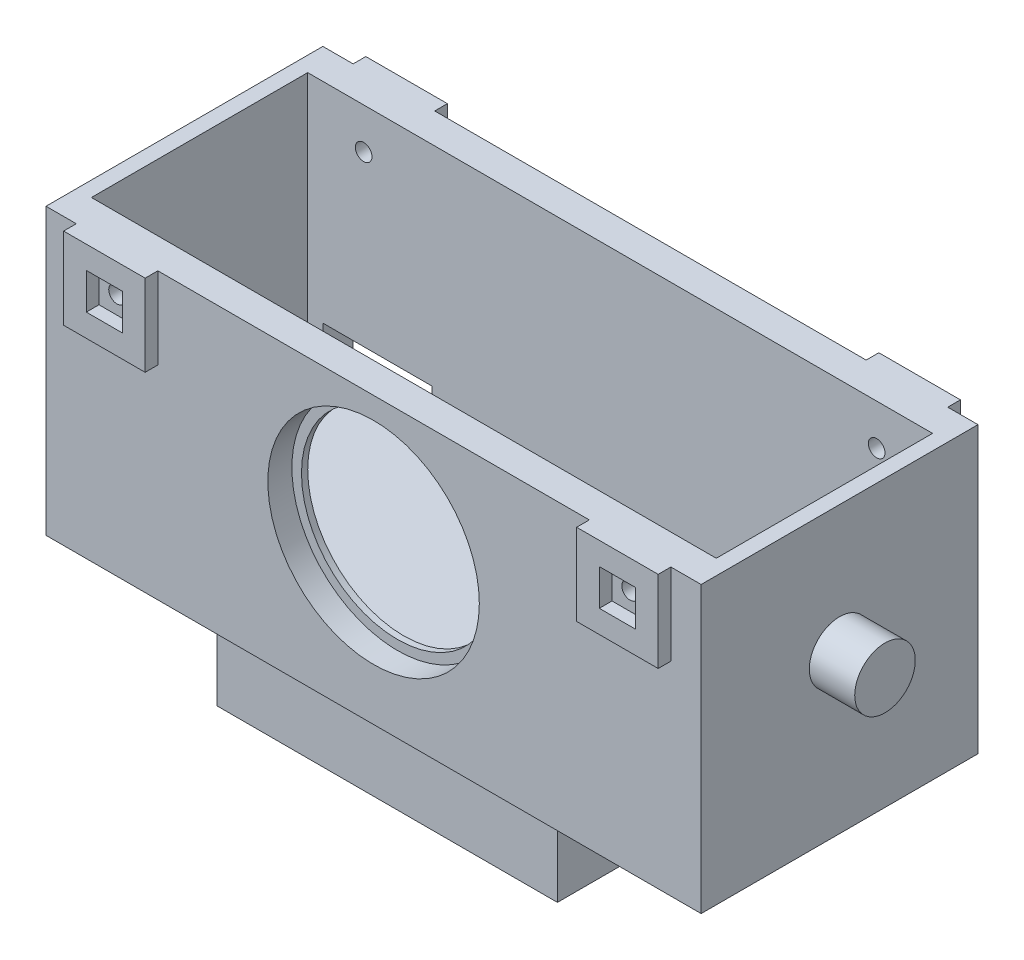
from build123d import *

# Parameters (mm, degrees)
SKETCH1_W                 = 36.575
SKETCH1_H                 = 41.655
SKETCH1_W_2               = 28.575
SKETCH1_H_2               = 33.655
BOSS_EXTRUDE1_DEPTH       = 41.275
SKETCH2_W                 = 36.575
SKETCH2_H                 = 41.655
BOSS_EXTRUDE2_DEPTH       = 2
SKETCH3_W                 = 86.55
SKETCH3_H                 = 36.575
CUT_EXTRUDE1_DEPTH        = 4
SKETCH4_W                 = 10.7752
SKETCH4_H                 = 10.7752
SKETCH4_W_2               = 4.7752
SKETCH4_H_2               = 4.7752
BOSS_EXTRUDE3_DEPTH       = 1.6764
MIRROR3_COPY_1_SKETCH_W   = 10.7752
MIRROR3_COPY_1_SKETCH_H   = 10.7752
MIRROR3_COPY_1_SKETCH_W_2 = 4.7752
MIRROR3_COPY_1_SKETCH_H_2 = 4.7752
MIRROR3_COPY_1_DEPTH      = 1.6764
SKETCH5_R                 = 1.1
CUT_EXTRUDE2_DEPTH        = 62.397719691
SKETCH6_R                 = 4
BOSS_EXTRUDE4_DEPTH       = 6
SKETCH7_R                 = 12.7
CUT_EXTRUDE3_DEPTH        = 4
SKETCH8_R                 = 13.97
CUT_EXTRUDE4_DEPTH        = 3.175
SKETCH9_W                 = 14.4
SKETCH9_H                 = 6
CUT_EXTRUDE5_DEPTH        = 4
SKETCH10_W                = 45
SKETCH10_H                = 33
SKETCH10_W_2              = 37
SKETCH10_H_2              = 25
BOSS_EXTRUDE5_DEPTH       = 10
SKETCH11_W                = 39
SKETCH11_H                = 27
CUT_EXTRUDE7_DEPTH        = 3.175
SKETCH14_W                = 16
SKETCH14_H                = 6
CUT_EXTRUDE8_DEPTH        = 4


with BuildPart() as part:
    # Sketch1 → Boss-Extrude1 (new, symmetric)
    with BuildSketch(Plane(origin=(0, 0, 0), x_dir=(0, 0, -1), z_dir=(1, 0, 0))):
        Rectangle(SKETCH1_W, SKETCH1_H)
        Rectangle(SKETCH1_W_2, SKETCH1_H_2, mode=Mode.SUBTRACT)
    extrude(amount=BOSS_EXTRUDE1_DEPTH, both=True)

    # Sketch2 → Boss-Extrude2 (add)
    with BuildSketch(Plane.ZY.offset(41.275)):
        Rectangle(SKETCH2_W, SKETCH2_H)
    boss_extrude2 = extrude(amount=BOSS_EXTRUDE2_DEPTH)

    # Mirror1: Boss-Extrude2 across plane
    add(boss_extrude2.mirror(Plane(origin=(0, 0, 0), x_dir=(0, 0, 1), z_dir=(1, 0, 0))))

    # Sketch3 → Cut-Extrude1 (cut)
    with BuildSketch(Plane(origin=(0, 20.8275, 0), x_dir=(1, 0, 0), z_dir=(0, 1, 0))):
        Rectangle(SKETCH3_W, SKETCH3_H)
    extrude(amount=-CUT_EXTRUDE1_DEPTH, mode=Mode.SUBTRACT)

    # Sketch4 → Boss-Extrude3 (add)
    with BuildSketch(Plane(origin=(0, 0, -18.2875), x_dir=(-1, 0, 0), z_dir=(0, 0, -1))):
        with Locations((-33.8874, 11.4399)):
            Rectangle(SKETCH4_W, SKETCH4_H)
        with Locations((-33.8874, 11.4399)):
            Rectangle(SKETCH4_W_2, SKETCH4_H_2, mode=Mode.SUBTRACT)
    boss_extrude3 = extrude(amount=BOSS_EXTRUDE3_DEPTH)

    # Mirror2: Boss-Extrude3 across plane
    add(boss_extrude3.mirror(Plane(origin=(0, 0, 0), x_dir=(0, 0, 1), z_dir=(1, 0, 0))))

    # Mirror3: Boss-Extrude3 across plane
    add(boss_extrude3.mirror(Plane.XY))

    # Mirror3 copy 1 sketch → Mirror3 copy 1 (add)
    with BuildSketch(Plane.XY.offset(18.2875)):
        with Locations((-33.8874, 11.4399)):
            Rectangle(MIRROR3_COPY_1_SKETCH_W, MIRROR3_COPY_1_SKETCH_H)
        with Locations((-33.8874, 11.4399)):
            Rectangle(MIRROR3_COPY_1_SKETCH_W_2, MIRROR3_COPY_1_SKETCH_H_2, mode=Mode.SUBTRACT)
    extrude(amount=MIRROR3_COPY_1_DEPTH)

    # Sketch5 → Cut-Extrude2 (cut, through all)
    with BuildSketch(Plane.XY.offset(18.2875)):
        with Locations((-33.8874, 11.4399)):
            Circle(SKETCH5_R)
    cut_extrude2 = extrude(amount=-CUT_EXTRUDE2_DEPTH, mode=Mode.SUBTRACT)

    # Mirror4: Cut-Extrude2 across plane
    add(cut_extrude2.mirror(Plane(origin=(0, 0, 0), x_dir=(0, 0, 1), z_dir=(1, 0, 0))), mode=Mode.SUBTRACT)

    # Sketch6 → Boss-Extrude4 (add)
    with BuildSketch(Plane.ZY.offset(43.275)):
        Circle(SKETCH6_R)
    boss_extrude4 = extrude(amount=BOSS_EXTRUDE4_DEPTH)

    # Mirror5: Boss-Extrude4 across plane
    add(boss_extrude4.mirror(Plane(origin=(0, 0, 0), x_dir=(0, 0, 1), z_dir=(1, 0, 0))))

    # Sketch7 → Cut-Extrude3 (cut)
    with BuildSketch(Plane.XY.offset(18.2875)):
        Circle(SKETCH7_R)
    extrude(amount=-CUT_EXTRUDE3_DEPTH, mode=Mode.SUBTRACT)

    # Sketch8 → Cut-Extrude4 (cut)
    with BuildSketch(Plane.XY.offset(18.2875)):
        Circle(SKETCH8_R)
    extrude(amount=-CUT_EXTRUDE4_DEPTH, mode=Mode.SUBTRACT)

    # Sketch9 → Cut-Extrude5 (cut)
    with BuildSketch(Plane(origin=(0, 0, -18.2875), x_dir=(-1, 0, 0), z_dir=(0, 0, -1))):
        with Locations((32.075, -13.8275)):
            Rectangle(SKETCH9_W, SKETCH9_H)
    extrude(amount=-CUT_EXTRUDE5_DEPTH, mode=Mode.SUBTRACT)

    # Sketch10 → Boss-Extrude5 (add)
    with BuildSketch(Plane.XZ.offset(20.8275)):
        Rectangle(SKETCH10_W, SKETCH10_H)
        Rectangle(SKETCH10_W_2, SKETCH10_H_2, mode=Mode.SUBTRACT)
    extrude(amount=BOSS_EXTRUDE5_DEPTH)

    # Sketch11 → Cut-Extrude7 (cut)
    with BuildSketch(Plane.XZ.offset(30.8275)):
        Rectangle(SKETCH11_W, SKETCH11_H)
    extrude(amount=-CUT_EXTRUDE7_DEPTH, mode=Mode.SUBTRACT)

    # Sketch14 → Cut-Extrude8 (cut)
    with BuildSketch(Plane(origin=(22.5, 0, 0), x_dir=(0, 0, -1), z_dir=(1, 0, 0))):
        with Locations((0, -23.8275)):
            Rectangle(SKETCH14_W, SKETCH14_H)
    extrude(amount=-CUT_EXTRUDE8_DEPTH, mode=Mode.SUBTRACT)


solid = part.part
